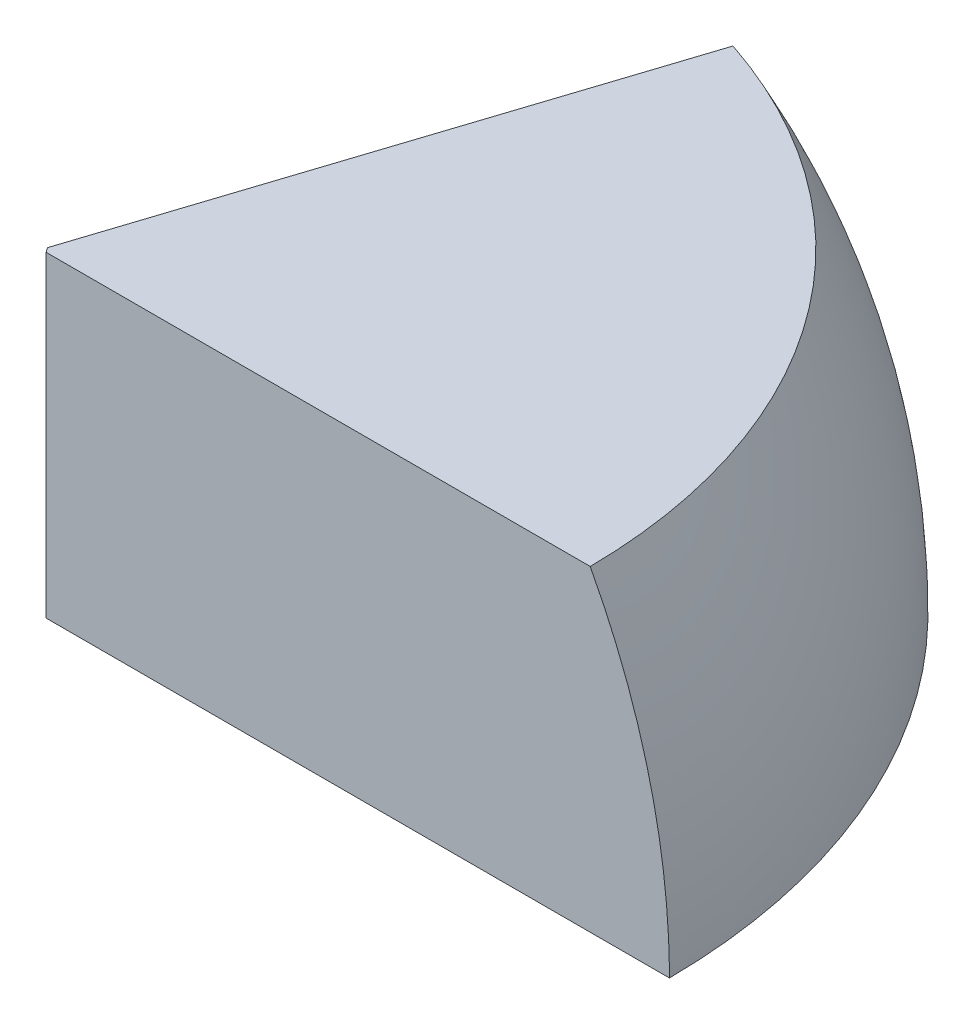
from build123d import *

# Parameters (mm, degrees)
REVOLVE1_ANGLE     = 72
CUT_EXTRUDE2_DEPTH = 0.635
CUT_EXTRUDE3_DEPTH = 0.635
CUT_EXTRUDE4_REACH = 151.001


with BuildPart() as part:
    # Sketch1 → Revolve1 (revolve)
    with BuildSketch(Plane.XY):
        with BuildLine():
            Line((0, 0), (0, 50.8))
            Line((0, 50.8), (88.9, 50.8))
            ThreePointArc((88.9, 50.8), (98.376882891, 26.181720723), (101.6, 0))
            Line((101.6, 0), (0, 0))
        make_face()
    revolve(axis=Axis((0, 0, 0), (0, 1, 0)), revolution_arc=REVOLVE1_ANGLE)

    # Sketch3 → Cut-Extrude2 (cut)
    with BuildSketch(Plane(origin=(0, 0, 0), x_dir=(-0.3090169943749449, 0, 0.9510565162951544), z_dir=(-0.9510565162951544, 0, -0.3090169943749449))):
        with BuildLine():
            Line((0, 50.8), (-88.9, 50.8))
            ThreePointArc((-88.9, 50.8), (-98.376882891, 26.181720723), (-101.6, 0))
            Line((-101.6, 0), (0, 0))
            Line((0, 0), (0, 50.8))
        make_face()
    extrude(amount=-CUT_EXTRUDE2_DEPTH, mode=Mode.SUBTRACT)

    # Sketch4 → Cut-Extrude3 (cut)
    with BuildSketch(Plane.XY):
        with BuildLine():
            Line((0.667678512, 50.8), (0.667678512, 0))
            Line((0.667678512, 0), (101.6, 0))
            ThreePointArc((101.6, 0), (98.376882891, 26.181720723), (88.9, 50.8))
            Line((88.9, 50.8), (0.667678512, 50.8))
        make_face()
    extrude(amount=-CUT_EXTRUDE3_DEPTH, mode=Mode.SUBTRACT)

    # Sketch5 → Cut-Extrude4 (cut, up to next)
    with BuildSketch(Plane(origin=(0, 50.8, 0), x_dir=(1, 0, 0), z_dir=(0, 1, 0)), mode=Mode.PRIVATE) as cut_extrude4_sk1:
        Polygon((1.658905685, 0.635), (0.874002519, 0.635), (1.116550937, 1.38148727), align=None)
    cut_extrude4_tool1 = extrude(cut_extrude4_sk1.sketch, amount=-CUT_EXTRUDE4_REACH, mode=Mode.PRIVATE) & part.part
    add(cut_extrude4_tool1.solids().sort_by_distance((1.216486, 50.8, -0.883829))[0], mode=Mode.SUBTRACT)


solid = part.part
